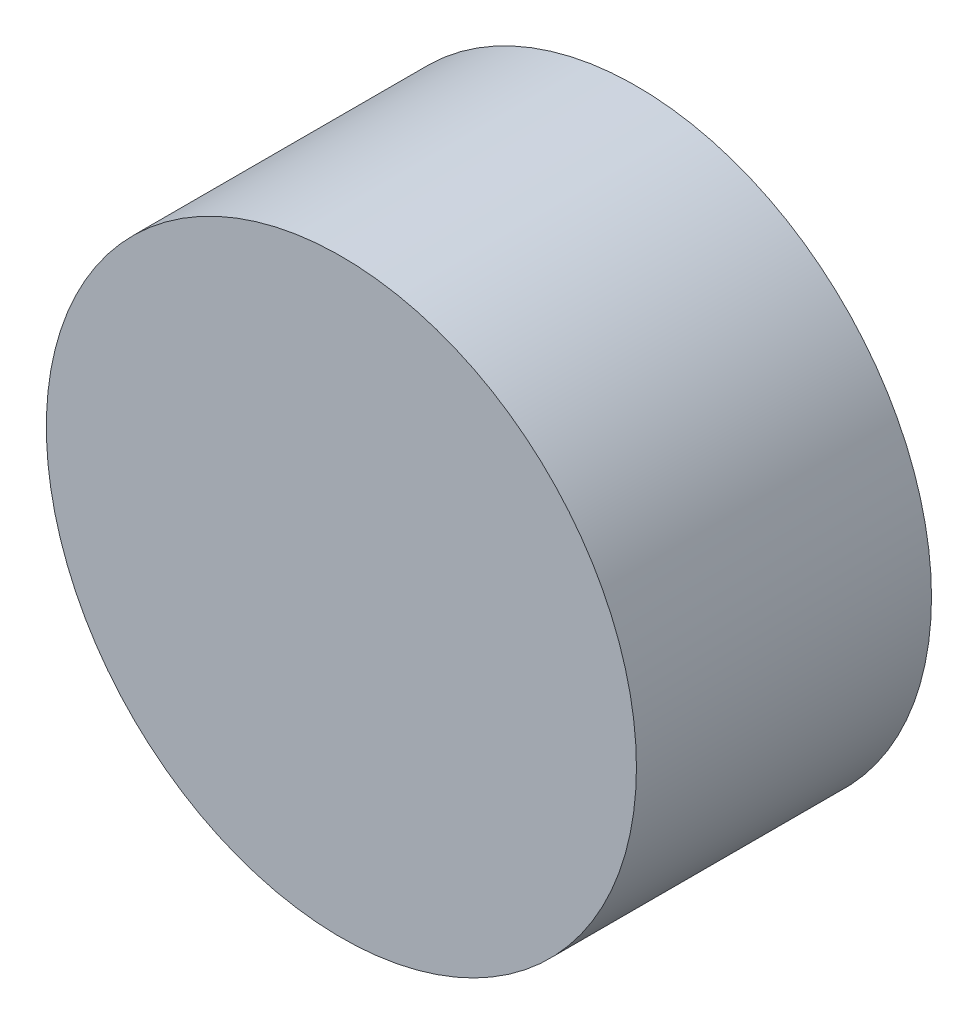
from build123d import *

# Parameters (mm, degrees)
SKETCH1_R           = 25.4
BOSS_EXTRUDE2_DEPTH = 25.4


with BuildPart() as part:
    # Sketch1 → Boss-Extrude2 (new body)
    with BuildSketch(Plane.XY):
        Circle(SKETCH1_R)
    extrude(amount=BOSS_EXTRUDE2_DEPTH)


solid = part.part
